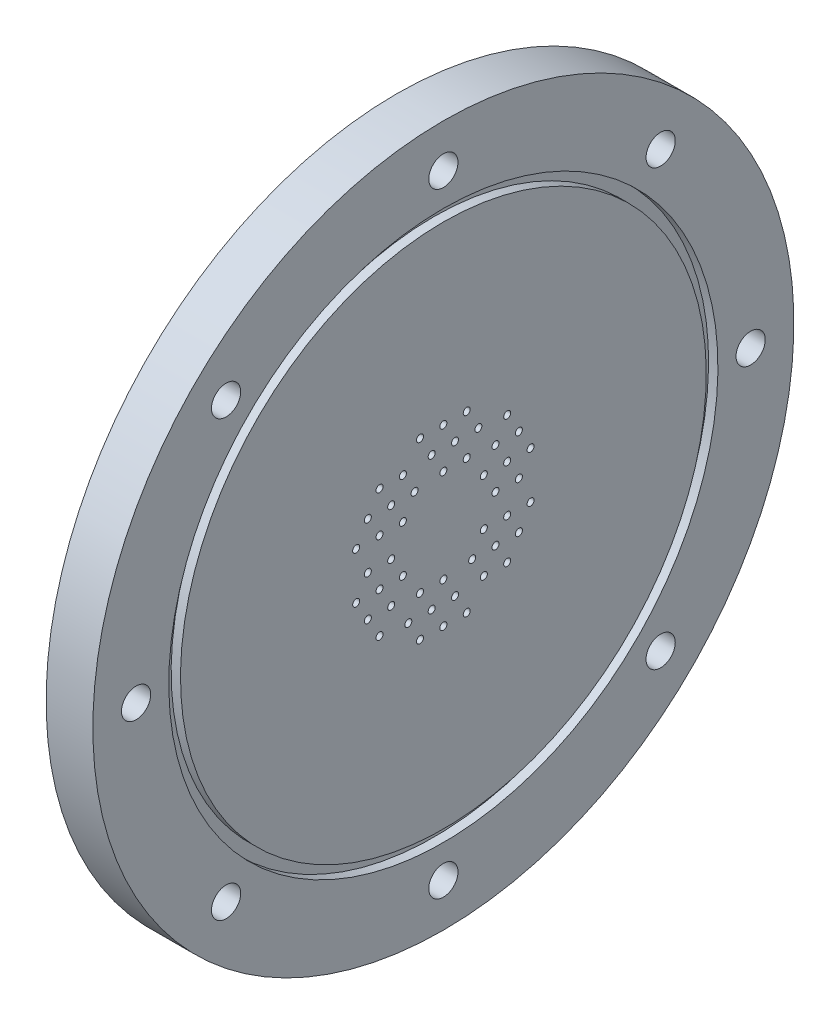
from build123d import *

# Parameters (mm, degrees)
SKETCH2_R                    = 0.762
CUT_EXTRUDE1_DEPTH           = 109.240960824
CHAMFER1_SIZE                = 0.508
CIRPATTERN1_COUNT            = 6
CHAMFER1_OF_CIRPATTERN1_SIZE = 0.508
SKETCH3_R                    = 3.175
CUT_EXTRUDE2_DEPTH           = 109.240960824
CIRPATTERN2_COUNT            = 8
SKETCH4_W                    = 2.032
SKETCH4_H                    = 2.54
SKETCH4_W_2                  = 1.27


with BuildPart() as part:
    # Sketch1 → Revolve1 (revolve)
    with BuildSketch(Plane.XY, mode=Mode.PRIVATE) as revolve1_sk:
        with BuildLine():
            Line((0, 0), (0, 48.26))
            ThreePointArc((0, 48.26), (-0.743948776, 50.056051224), (-2.54, 50.8))
            Line((-2.54, 50.8), (-6.35, 50.8))
            Line((-6.35, 50.8), (-6.35, 76.2))
            Line((-6.35, 76.2), (3.81, 76.2))
            Line((3.81, 76.2), (3.81, 0))
            Line((3.81, 0), (0, 0))
        make_face()
    revolve(revolve1_sk.sketch.rotate(Axis((-6.35, 0, 0), (1, 0, 0)), 180), axis=Axis((-6.35, 0, 0), (1, 0, 0)))

    # Sketch2 → Cut-Extrude1 (cut, through all)
    with BuildSketch(Plane(origin=(3.81, 0, 0), x_dir=(0, 0, -1), z_dir=(1, 0, 0))):
        with Locations(Location((0, 10.16, 0), (0, 0, 90))):
            Circle(SKETCH2_R)
        with Locations(Location((-2.54, 14.559409051, 0), (0, 0, 90))):
            Circle(SKETCH2_R)
        with Locations(Location((5.08, 10.16, 0), (0, 0, 90))):
            Circle(SKETCH2_R)
        with Locations(Location((-5.08, 18.958818102, 0), (0, 0, 90))):
            Circle(SKETCH2_R)
        with Locations(Location((0, 18.958818102, 0), (0, 0, 90))):
            Circle(SKETCH2_R)
        with Locations(Location((5.08, 18.958818102, 0), (0, 0, 90))):
            Circle(SKETCH2_R)
        with Locations(Location((7.62, 14.559409051, 0), (0, 0, 90))):
            Circle(SKETCH2_R)
        with Locations(Location((2.54, 14.559409051, 0), (0, 0, 90))):
            Circle(SKETCH2_R)
    cut_extrude1 = extrude(amount=-CUT_EXTRUDE1_DEPTH, mode=Mode.SUBTRACT)

    # Chamfer1
    chamfer1_edges = [part.edges().sort_by_distance(p)[0] for p in [
        (0, 18.196818102, 5.08),
        (0, 13.797409051, 2.54),
        (0, 18.196818102, 0),
        (0, 18.196818102, -5.08),
        (0, 13.797409051, -7.62),
        (0, 13.797409051, -2.54),
        (0, 9.398, 0),
        (0, 9.398, -5.08),
    ]]
    chamfer(chamfer1_edges, length=CHAMFER1_SIZE)

    # CirPattern1: Cut-Extrude1 ×6 about axis
    cirpattern1_axis = Axis((0, 0, 0), (1, 0, 0))
    for i in range(1, CIRPATTERN1_COUNT):
        add(cut_extrude1.rotate(cirpattern1_axis, i * 360 / CIRPATTERN1_COUNT), mode=Mode.SUBTRACT)

    # Chamfer1 of CirPattern1
    chamfer1_of_cirpattern1_edges = [part.edges().sort_by_distance(p)[0] for p in [
        (0, 4.699, 18.298906745),
        (0, 4.699, 13.218906745),
        (0, 9.098409051, 15.758906745),
        (0, 13.497818102, 13.218906745),
        (0, 13.497818102, 8.138906745),
        (0, 9.098409051, 10.678906745),
        (0, 4.699, 8.138906745),
        (0, 9.098409051, 5.598906745),
        (0, -13.497818102, 13.218906745),
        (0, -9.098409051, 10.678906745),
        (0, -9.098409051, 15.758906745),
        (0, -4.699, 18.298906745),
        (0, -0.299590949, 15.758906745),
        (0, -4.699, 13.218906745),
        (0, -4.699, 8.138906745),
        (0, -0.299590949, 10.678906745),
        (0, -18.196818102, -5.08),
        (0, -13.797409051, -2.54),
        (0, -18.196818102, 0),
        (0, -18.196818102, 5.08),
        (0, -13.797409051, 7.62),
        (0, -13.797409051, 2.54),
        (0, -9.398, 0),
        (0, -9.398, 5.08),
        (0, -4.699, -18.298906745),
        (0, -4.699, -13.218906745),
        (0, -9.098409051, -15.758906745),
        (0, -13.497818102, -13.218906745),
        (0, -13.497818102, -8.138906745),
        (0, -9.098409051, -10.678906745),
        (0, -4.699, -8.138906745),
        (0, -9.098409051, -5.598906745),
        (0, 13.497818102, -13.218906745),
        (0, 9.098409051, -10.678906745),
        (0, 9.098409051, -15.758906745),
        (0, 4.699, -18.298906745),
        (0, 0.299590949, -15.758906745),
        (0, 4.699, -13.218906745),
        (0, 4.699, -8.138906745),
        (0, 0.299590949, -10.678906745),
    ]]
    chamfer(chamfer1_of_cirpattern1_edges, length=CHAMFER1_OF_CIRPATTERN1_SIZE)

    # Sketch3 → Cut-Extrude2 (cut, through all)
    with BuildSketch(Plane(origin=(3.81, 0, 0), x_dir=(0, 0, -1), z_dir=(1, 0, 0))):
        with Locations(Location((-66.802, 0, 0), (0, 0, 90))):
            Circle(SKETCH3_R)
    cut_extrude2 = extrude(amount=-CUT_EXTRUDE2_DEPTH, mode=Mode.SUBTRACT)

    # CirPattern2: Cut-Extrude2 ×8 about axis
    cirpattern2_axis = Axis((0, 0, 0), (1, 0, 0))
    for i in range(1, CIRPATTERN2_COUNT):
        add(cut_extrude2.rotate(cirpattern2_axis, i * 360 / CIRPATTERN2_COUNT), mode=Mode.SUBTRACT)

    # Sketch4 → Cut-Revolve1 (revolve, cut)
    with BuildSketch(Plane.XY):
        with Locations((2.794, 58.42)):
            Rectangle(SKETCH4_W, SKETCH4_H)
        with Locations((-5.334, 58.42)):
            Rectangle(SKETCH4_W, SKETCH4_H)
        with Locations((-5.715, 52.07)):
            Rectangle(SKETCH4_W_2, SKETCH4_H)
    revolve(axis=Axis((0, 0, 0), (-1, 0, 0)), mode=Mode.SUBTRACT)


solid = part.part
